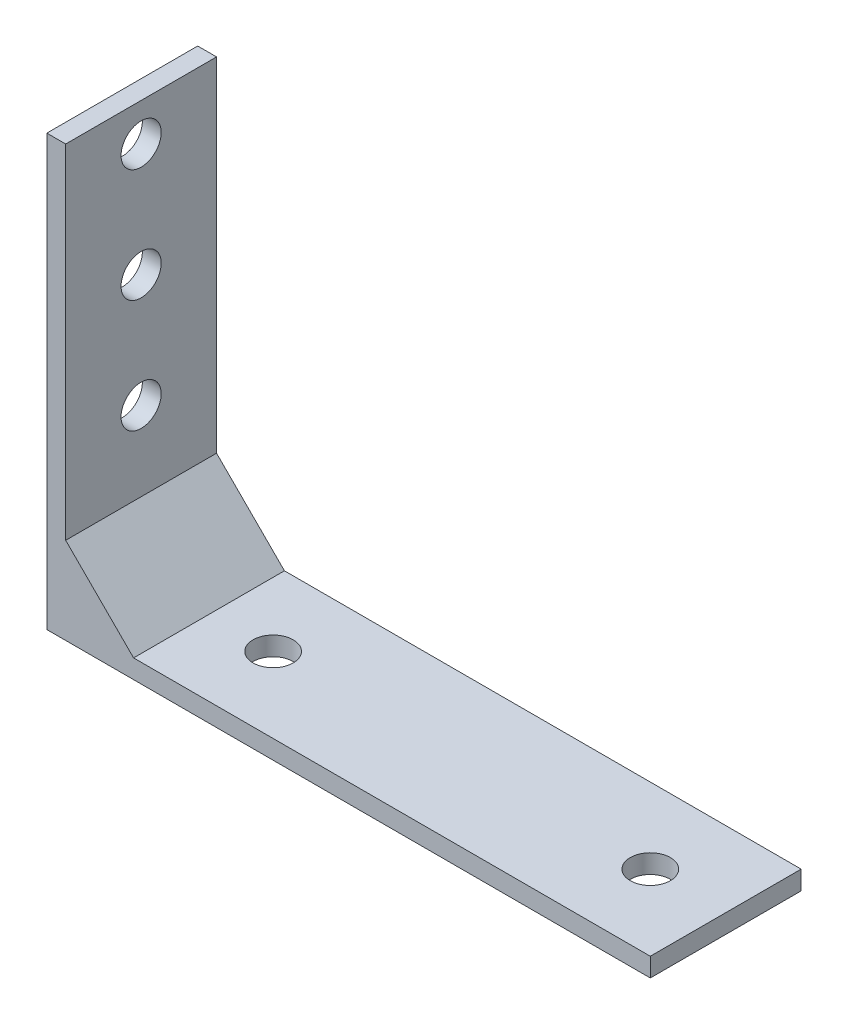
from build123d import *

# Parameters (mm, degrees)
BOSS_EXTRUDE1_DEPTH = 25.4
SKETCH2_R           = 3.3782
CUT_EXTRUDE1_DEPTH  = 25.4
SKETCH3_R           = 3.3782
CUT_EXTRUDE2_DEPTH  = 128.310769772
BOSS_EXTRUDE2_DEPTH = 25.4


with BuildPart() as part:
    # Sketch1 → Boss-Extrude1 (new body)
    with BuildSketch(Plane.XY):
        Polygon((0, 3.175), (0, 0), (3.175, 0), (101.6, 0), (101.6, 3.175), (3.175, 3.175), (3.175, 72.39), (0, 72.39), align=None)
    extrude(amount=BOSS_EXTRUDE1_DEPTH)

    # Sketch2 → Cut-Extrude1 (cut)
    with BuildSketch(Plane(origin=(0, 3.175, 0), x_dir=(1, 0, 0), z_dir=(0, 1, 0))):
        with Locations(Location((88.9, -12.7, 0), (0, 0, 270))):
            Circle(SKETCH2_R)
        with Locations(Location((25.4, -12.7, 0), (0, 0, 270))):
            Circle(SKETCH2_R)
    extrude(amount=-CUT_EXTRUDE1_DEPTH, mode=Mode.SUBTRACT)

    # Sketch3 → Cut-Extrude2 (cut, through all)
    with BuildSketch(Plane.ZY):
        with Locations((12.7, 27.94)):
            Circle(SKETCH3_R)
        with Locations((12.7, 46.99)):
            Circle(SKETCH3_R)
        with Locations((12.7, 66.04)):
            Circle(SKETCH3_R)
    extrude(amount=-CUT_EXTRUDE2_DEPTH, mode=Mode.SUBTRACT)

    # Sketch4 → Boss-Extrude2 (add)
    with BuildSketch(Plane.XY.offset(25.4)):
        Polygon((3.175, 14.605), (14.605, 3.175), (3.175, 3.175), align=None)
    extrude(amount=-BOSS_EXTRUDE2_DEPTH)


solid = part.part
